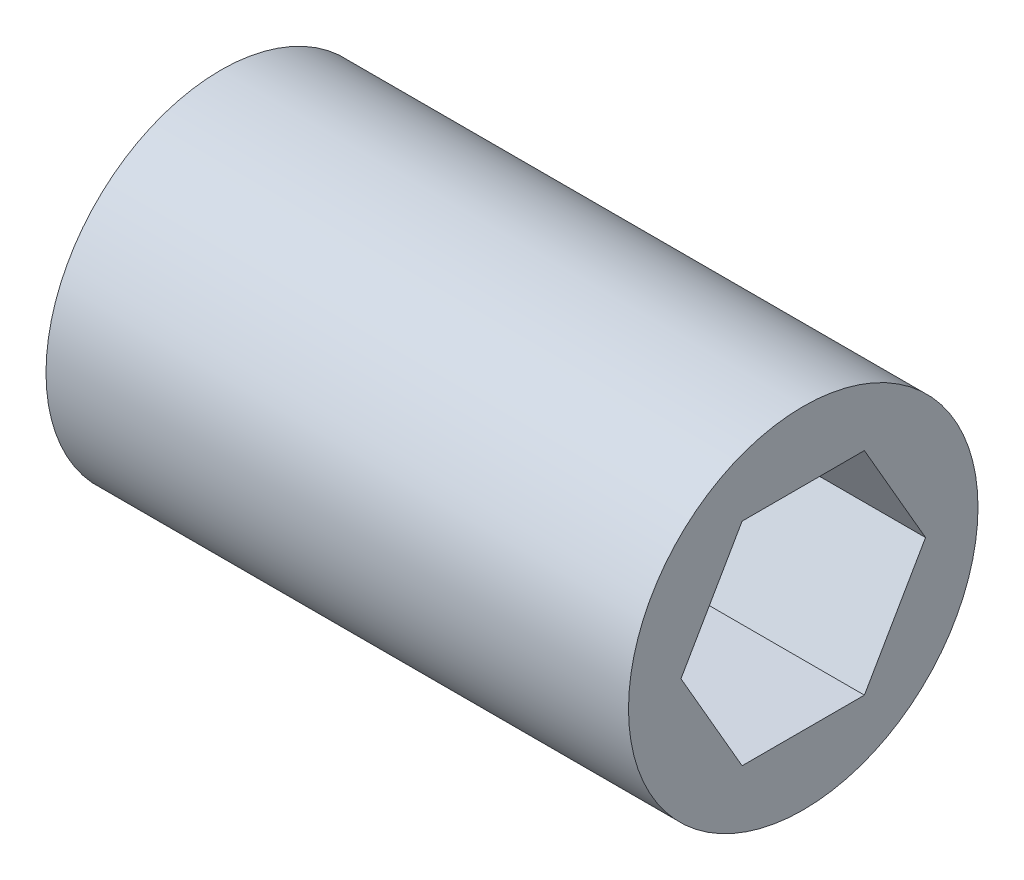
from build123d import *

# Parameters (mm, degrees)
SKETCH1_R           = 10.4775
BOSS_EXTRUDE1_DEPTH = 17.4625


with BuildPart() as part:
    # Sketch1 → Boss-Extrude1 (new, symmetric)
    with BuildSketch(Plane(origin=(0, 0, 0), x_dir=(0, 0, -1), z_dir=(1, 0, 0))):
        Circle(SKETCH1_R)
        Polygon((3.666174209, 6.35), (-3.666174209, 6.35), (-7.332348419, 0), (-3.666174209, -6.35), (3.666174209, -6.35), (7.332348419, 0), align=None, mode=Mode.SUBTRACT)
    extrude(amount=BOSS_EXTRUDE1_DEPTH, both=True)


solid = part.part
